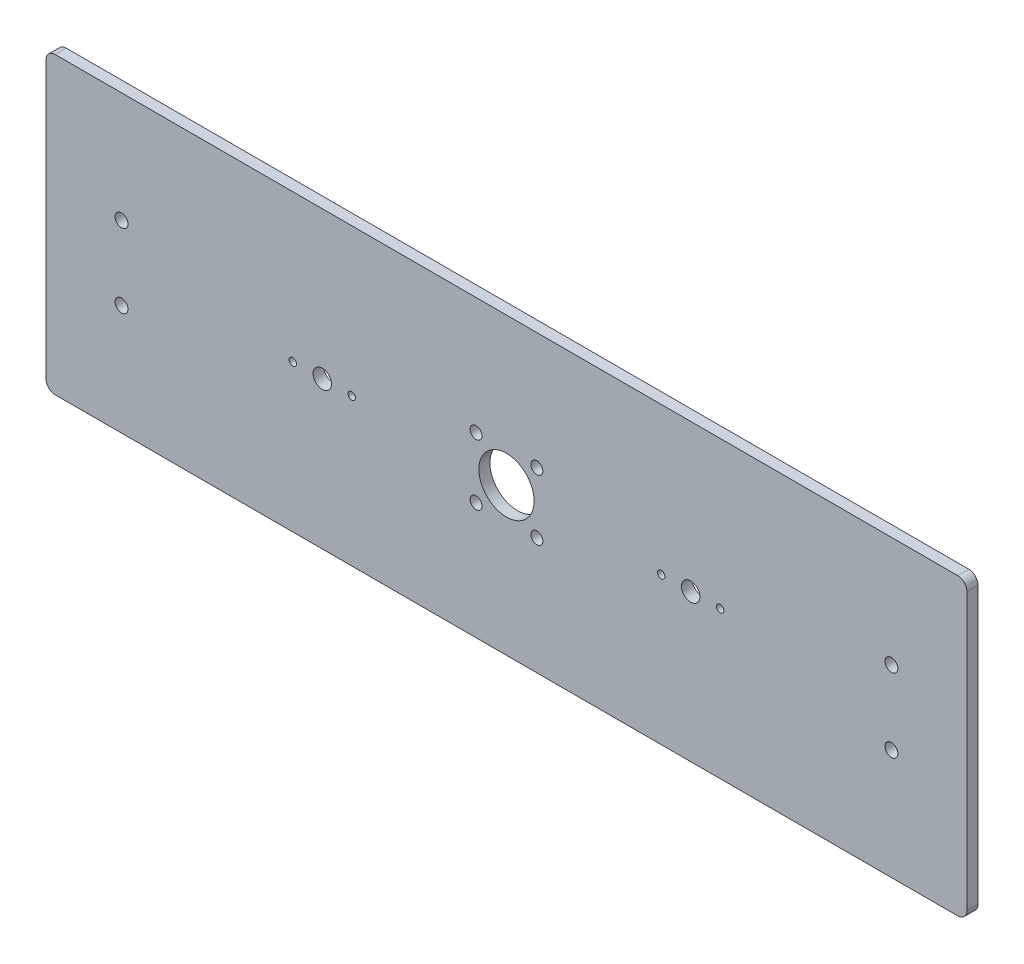
from build123d import *

# Parameters (mm, degrees)
SKETCH2_W           = 500
SKETCH2_H           = 160
SKETCH2_R           = 15
SKETCH2_R_2         = 5
SKETCH2_R_3         = 3.5
SKETCH2_R_4         = 2
SKETCH2_R_5         = 3.25
BOSS_EXTRUDE1_DEPTH = 6
FILLET1_R           = 5


with BuildPart() as part:
    # Sketch2 → Boss-Extrude1 (new body)
    with BuildSketch(Plane.XY):
        with Locations((50, 0)):
            Rectangle(SKETCH2_W, SKETCH2_H)
        with Locations((50, 0)):
            Circle(SKETCH2_R, mode=Mode.SUBTRACT)
        with Locations((-50, 0)):
            Circle(SKETCH2_R_2, mode=Mode.SUBTRACT)
        with Locations((150, 0)):
            Circle(SKETCH2_R_2, mode=Mode.SUBTRACT)
        with Locations((-159, 20)):
            Circle(SKETCH2_R_3, mode=Mode.SUBTRACT)
        with Locations((-159, -20)):
            Circle(SKETCH2_R_3, mode=Mode.SUBTRACT)
        with Locations((259, -20)):
            Circle(SKETCH2_R_3, mode=Mode.SUBTRACT)
        with Locations((259, 20)):
            Circle(SKETCH2_R_3, mode=Mode.SUBTRACT)
        with Locations((134, 0)):
            Circle(SKETCH2_R_4, mode=Mode.SUBTRACT)
        with Locations((166, 0)):
            Circle(SKETCH2_R_4, mode=Mode.SUBTRACT)
        with Locations((-66, 0)):
            Circle(SKETCH2_R_4, mode=Mode.SUBTRACT)
        with Locations((-34, 0)):
            Circle(SKETCH2_R_4, mode=Mode.SUBTRACT)
        with Locations((66.5, 16.5)):
            Circle(SKETCH2_R_5, mode=Mode.SUBTRACT)
        with Locations((33.5, 16.5)):
            Circle(SKETCH2_R_5, mode=Mode.SUBTRACT)
        with Locations((33.5, -16.5)):
            Circle(SKETCH2_R_5, mode=Mode.SUBTRACT)
        with Locations((66.5, -16.5)):
            Circle(SKETCH2_R_5, mode=Mode.SUBTRACT)
    extrude(amount=BOSS_EXTRUDE1_DEPTH)

    # Fillet1
    fillet1_edges = [part.edges().sort_by_distance(p)[0] for p in [
        (-200, -80, 3),
        (-200, 80, 3),
        (300, 80, 3),
        (300, -80, 3),
    ]]
    fillet(fillet1_edges, radius=FILLET1_R)


solid = part.part
